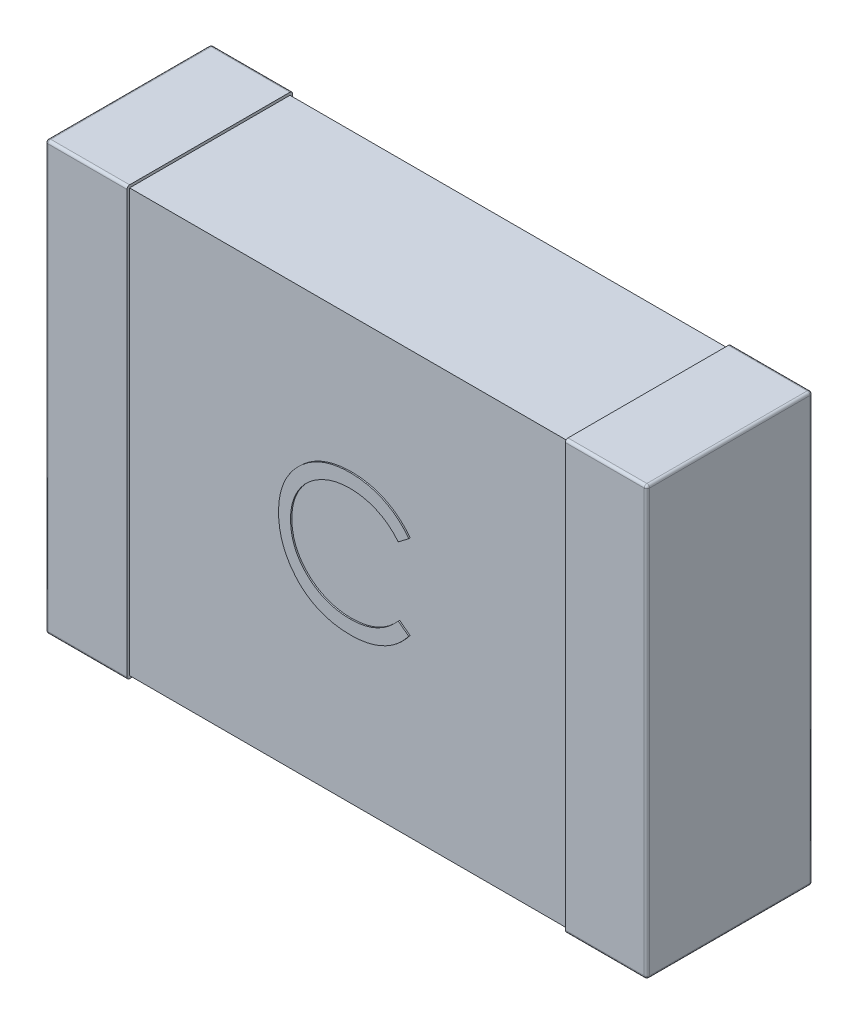
from build123d import *

# Parameters (mm, degrees)
EXTRUDE_1_DEPTH        = 1.22
EXTRUDE_1_DEPTH_BACK   = 0.02
SKETCH_3_W             = 0.61
SKETCH_3_H             = 3.2
EXTRUDE_1_2_DEPTH      = 1.22
EXTRUDE_1_2_DEPTH_BACK = 0.02
SKETCH_5_W             = 1.2
SKETCH_5_H             = 3.16
EXTRUDE_3_DEPTH        = 1.66
FILLET_3_R             = 0.02
EXTRUDE_4_DEPTH        = 0.01


with BuildPart() as part:
    # 草图3 → 凸台-拉伸1 (new, two sides: drawn at the far end of the back side and taken through both)
    with BuildSketch(Plane.XY.offset(-EXTRUDE_1_DEPTH_BACK)):
        with Locations((-1.945, 0)):
            Rectangle(SKETCH_3_W, SKETCH_3_H)
    extrude(amount=EXTRUDE_1_DEPTH + EXTRUDE_1_DEPTH_BACK)



with BuildPart() as body_2:
    # 草图3 → Extrude 1 2 (new, two sides: drawn at the far end of the back side and taken through both)
    with BuildSketch(Plane.XY.offset(-EXTRUDE_1_2_DEPTH_BACK)):
        with Locations((1.945, 0)):
            Rectangle(SKETCH_3_W, SKETCH_3_H)
    extrude(amount=EXTRUDE_1_2_DEPTH + EXTRUDE_1_2_DEPTH_BACK)


with BuildPart() as part_1:
    add(part.part)

    add(body_2.part)  # 凸台-拉伸3 merges body 2
    # 草图5 → 凸台-拉伸3 (add, symmetric)
    with BuildSketch(Plane(origin=(0, 0, 0), x_dir=(0, 0, -1), z_dir=(1, 0, 0))):
        with Locations((-0.6, 0)):
            Rectangle(SKETCH_5_W, SKETCH_5_H)
    extrude(amount=EXTRUDE_3_DEPTH, both=True)

    # 圆角3
    fillet_3_edges = [part_1.edges().sort_by_distance(p)[0] for p in [
        (-2.25, 0, -0.02),
        (-1.945, 1.6, 1.22),
        (-1.945, -1.6, -0.02),
        (-2.25, 0, 1.22),
        (-1.945, -1.6, 1.22),
        (2.25, 1.6, 0.6),
        (2.25, 0, -0.02),
        (2.25, -1.6, 0.6),
        (1.945, -1.6, -0.02),
        (1.945, 1.6, -0.02),
        (2.25, 0, 1.22),
        (1.945, 1.6, 1.22),
        (1.945, -1.6, 1.22),
        (-1.945, 1.6, -0.02),
        (-2.25, -1.6, 0.6),
        (-2.25, 1.6, 0.6),
    ]]
    fillet(fillet_3_edges, radius=FILLET_3_R)

    # 草图6 → 凸台-拉伸4 (add)
    with BuildSketch(Plane.XY.offset(1.2)):
        with BuildLine():
            Line((0.458404382, 0.361329361), (0.379878741, 0.301233207))
            add(Edge.make_bspline(
                [(0.379878741, 0.301233207), (0.374277059, 0.307909199), (0.363149217, 0.321171175), (0.345246588, 0.339793902), (0.326588975, 0.357241119), (0.307183512, 0.373595942), (0.286680907, 0.388286446), (0.265577821, 0.40207819), (0.243521237, 0.414440401), (0.213020741, 0.429429826), (0.173121356, 0.445071584), (0.122894259, 0.458186793), (0.070462517, 0.4665357), (0.034691774, 0.467439941), (0.016497331, 0.467899874)],
                knots=[0, 0, 0, 0, 0.757959112, 1.505699292, 2.245454638, 2.979532153, 3.711538275, 4.438200793, 5.171680507, 5.909471876, 7.393775596, 8.890124382, 10.418191784, 12, 12, 12, 12], degree=3))
            add(Edge.make_bspline(
                [(0.016497331, 0.467899874), (0.006473531, 0.467784456), (-0.013481038, 0.467554692), (-0.043094888, 0.464523513), (-0.072155759, 0.460263167), (-0.10064475, 0.453941646), (-0.128525595, 0.445949469), (-0.155980567, 0.436399351), (-0.182612167, 0.424583683), (-0.208788806, 0.41152418), (-0.233868581, 0.396773481), (-0.257598595, 0.380683952), (-0.2798923, 0.363435639), (-0.300767332, 0.344963894), (-0.320245031, 0.325351906), (-0.338184263, 0.304390665), (-0.354522952, 0.282147187), (-0.369584959, 0.258914785), (-0.383074311, 0.23476113), (-0.394368562, 0.209596824), (-0.404370026, 0.183852795), (-0.412284095, 0.157238177), (-0.418548243, 0.129940244), (-0.422870432, 0.101885733), (-0.425867138, 0.073133254), (-0.42609576, 0.053644879), (-0.426211002, 0.043821348)],
                knots=[0, 0, 0, 0, 1.054917814, 2.100044995, 3.131103042, 4.146048494, 5.169673617, 6.183595914, 7.203665975, 8.234915748, 9.262203917, 10.264457458, 11.251630812, 12.227803204, 13.197192746, 14.159520551, 15.12972552, 16.100847026, 17.073214652, 18.039054194, 19.002613845, 19.979014051, 20.95965708, 21.949030935, 22.966165397, 24, 24, 24, 24], degree=3))
            add(Edge.make_bspline(
                [(-0.426211002, 0.043821348), (-0.425850483, 0.029040971), (-0.42514265, 2.1661e-05), (-0.418843126, -0.042484227), (-0.409270243, -0.08320442), (-0.394922935, -0.121884375), (-0.377231778, -0.159001049), (-0.354877317, -0.193926435), (-0.328986878, -0.227188311), (-0.299194187, -0.258000582), (-0.266506811, -0.28614736), (-0.231435979, -0.310933241), (-0.194069039, -0.331594636), (-0.154818574, -0.348787763), (-0.113382541, -0.362003971), (-0.069835455, -0.371308006), (-0.024272027, -0.377377201), (0.006862087, -0.377958255), (0.022707267, -0.378253972)],
                knots=[0, 0, 0, 0, 1.029171465, 2.020641659, 2.987623507, 3.938342917, 4.889210282, 5.84687017, 6.821220943, 7.821438502, 8.827599549, 9.822697543, 10.807740252, 11.797342354, 12.80366471, 13.83203677, 14.896651826, 16, 16, 16, 16], degree=3))
            add(Edge.make_bspline(
                [(0.022707267, -0.378253972), (0.040165178, -0.377771464), (0.074526524, -0.376821771), (0.124917388, -0.368776272), (0.173156178, -0.355731152), (0.219245489, -0.337474603), (0.263055388, -0.313741664), (0.304654434, -0.284970842), (0.344077739, -0.250888461), (0.36778382, -0.22486471), (0.379878741, -0.211587305)],
                knots=[0, 0, 0, 0, 1.028121516, 2.023589091, 2.998037872, 3.967518031, 4.937445131, 5.927275754, 6.942489185, 8, 8, 8, 8], degree=3))
            Line((0.379878741, -0.211587305), (0.458404382, -0.271082498))
            add(Edge.make_bspline(
                [(0.458404382, -0.271082498), (0.452084922, -0.279236341), (0.439476272, -0.295504972), (0.419059696, -0.318439746), (0.397551897, -0.340012327), (0.374793123, -0.360048791), (0.351045182, -0.378950066), (0.325881664, -0.396179161), (0.299633369, -0.411976557), (0.272389232, -0.426441392), (0.2441782, -0.439274891), (0.215034076, -0.450261682), (0.185082483, -0.459725936), (0.154322052, -0.467512204), (0.122688979, -0.473589656), (0.090297415, -0.477652421), (0.05707745, -0.480435825), (0.034665616, -0.480689515), (0.023308229, -0.480818075)],
                knots=[0, 0, 0, 0, 0.986787822, 1.968848986, 2.935600012, 3.899624008, 4.868462664, 5.837806735, 6.815139263, 7.798259679, 8.787526145, 9.778297419, 10.776456485, 11.791383307, 12.812564526, 13.85620153, 14.913611965, 16, 16, 16, 16], degree=3))
            add(Edge.make_bspline(
                [(0.023308229, -0.480818075), (0.012552895, -0.48074322), (-0.008714445, -0.480595203), (-0.040114088, -0.478197441), (-0.07068254, -0.474926088), (-0.100332433, -0.470000336), (-0.129225569, -0.464187667), (-0.157100021, -0.45639588), (-0.184230082, -0.447667546), (-0.21050675, -0.437408979), (-0.235952379, -0.425832927), (-0.260484896, -0.412749624), (-0.28409302, -0.398269091), (-0.307008854, -0.382710517), (-0.328893878, -0.365574145), (-0.349937743, -0.347097964), (-0.37025845, -0.327344246), (-0.382830646, -0.313100002), (-0.389151707, -0.305938267)],
                knots=[0, 0, 0, 0, 1.114604814, 2.203992996, 3.262667896, 4.300477797, 5.318619304, 6.316056647, 7.298880507, 8.271930387, 9.238335007, 10.195173496, 11.151986948, 12.108099108, 13.064862484, 14.031167946, 15.010108607, 16, 16, 16, 16], degree=3))
            add(Edge.make_bspline(
                [(-0.389151707, -0.305938267), (-0.399276177, -0.293497927), (-0.419402885, -0.268767439), (-0.44515308, -0.22868573), (-0.467195239, -0.18683767), (-0.48501693, -0.143003405), (-0.49894914, -0.097281294), (-0.50860091, -0.04964829), (-0.514872797, -0.000148878), (-0.515590022, 0.033518776), (-0.515954592, 0.050632246)],
                knots=[0, 0, 0, 0, 0.994628077, 1.977248131, 2.950237994, 3.925870899, 4.908910175, 5.911660606, 6.938484602, 8, 8, 8, 8], degree=3))
            add(Edge.make_bspline(
                [(-0.515954592, 0.050632246), (-0.515510251, 0.068619518), (-0.514636038, 0.104008354), (-0.507208668, 0.155943769), (-0.49526044, 0.205701312), (-0.478289901, 0.253188096), (-0.456774086, 0.29865389), (-0.430195053, 0.341751377), (-0.398861584, 0.382756177), (-0.363019422, 0.421046106), (-0.323714469, 0.45605735), (-0.281623379, 0.486859122), (-0.236828537, 0.512492698), (-0.189823437, 0.533920173), (-0.140256099, 0.55039002), (-0.08823228, 0.561919502), (-0.033849732, 0.569095821), (0.003253818, 0.570003023), (0.022106305, 0.570463977)],
                knots=[0, 0, 0, 0, 1.032925535, 2.032216505, 3.007276963, 3.968222605, 4.92396291, 5.891752235, 6.871517503, 7.883894988, 8.900124299, 9.891468569, 10.874487609, 11.85992873, 12.854644235, 13.869047385, 14.917252991, 16, 16, 16, 16], degree=3))
            add(Edge.make_bspline(
                [(0.022106305, 0.570463977), (0.033596155, 0.570326223), (0.056339154, 0.570053553), (0.089982769, 0.567394655), (0.122737719, 0.562962196), (0.154626571, 0.556929034), (0.185804462, 0.549441228), (0.216033102, 0.539686857), (0.24548987, 0.528533562), (0.273988986, 0.515688286), (0.301393715, 0.501269217), (0.32769552, 0.485436182), (0.35268548, 0.468208809), (0.376539436, 0.449733616), (0.398858354, 0.429619742), (0.420275919, 0.408420428), (0.440064799, 0.38552505), (0.452279997, 0.369409355), (0.458404382, 0.361329361)],
                knots=[0, 0, 0, 0, 1.096760587, 2.17092713, 3.219439832, 4.250915756, 5.268269357, 6.278326846, 7.281116186, 8.274029601, 9.260640565, 10.235837813, 11.203064059, 12.156899882, 13.114053108, 14.069676657, 15.032185724, 16, 16, 16, 16], degree=3))
        make_face()
    extrude(amount=EXTRUDE_4_DEPTH)


solid = part_1.part
